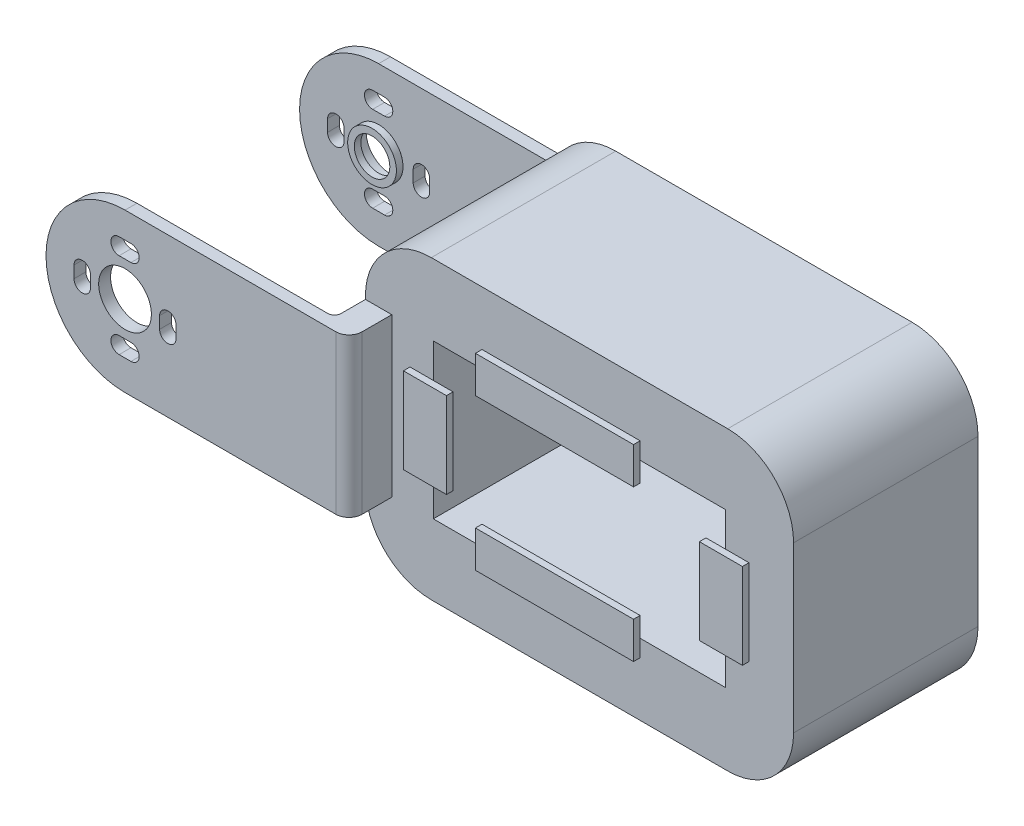
from build123d import *

# Parameters (mm, degrees)
SKETCH_1_W             = 65
SKETCH_1_H             = 45
EXTRUDE_1_DEPTH        = 28
SKETCH_2_W             = 44.4
SKETCH_2_H             = 23.4
CUT_EXTRUDE_1_DEPTH    = 39
SKETCH_3_W             = 4
SKETCH_3_H             = 24
EXTRUDE_2_DEPTH        = 6
EXTRUDE_START          = -0.3
SKETCH_7_R             = 4
EXTRUDE_3_DEPTH        = 1.8
SKETCH_8_W             = 4
SKETCH_8_H             = 24
EXTRUDE_4_DEPTH        = 6
FILLET_1_R             = 10
FILLET_2_R             = 10
FILLET_3_R             = 10
FILLET_4_R             = 10
PATTERN_LINEAR_2_COUNT = 2
PATTERN_LINEAR_2_PITCH = 38.5
FILLET_5_R             = 2
SKETCH_9_R             = 3.7
SKETCH_9_R_2           = 2.7
EXTRUDE_5_DEPTH        = 1
EXTRUDE_6_DEPTH        = 1
EXTRUDE_6_2_DEPTH      = 1
EXTRUDE_6_3_DEPTH      = 1
EXTRUDE_6_4_DEPTH      = 1
EXTRUDE_START_2        = 1.8
SKETCH_12_R            = 4
SKETCH_12_R_2          = 3.7
EXTRUDE_8_DEPTH        = 1.8
SKETCH_15_W            = 4
SKETCH_15_H            = 24
EXTRUDE_10_DEPTH       = 0.5
FILLET_16_R            = 2
FILLET_17_R            = 1
FILLET_18_R            = 1


with BuildPart() as part:
    # 草圖1 → 填料-伸長1 (new body)
    with BuildSketch(Plane.XY):
        with Locations((-27.434655272, 0)):
            Rectangle(SKETCH_1_W, SKETCH_1_H)
    extrude(amount=EXTRUDE_1_DEPTH)

    # 草圖2 → 除料-伸長1 (cut)
    with BuildSketch(Plane.XY):
        with Locations((-27.434655272, 0)):
            Rectangle(SKETCH_2_W, SKETCH_2_H)
    extrude(amount=CUT_EXTRUDE_1_DEPTH, mode=Mode.SUBTRACT)

    # 草圖3 → 填料-伸長2 (add)
    with BuildSketch(Plane.XY.offset(28)):
        with Locations((-57.934655272, 0)):
            Rectangle(SKETCH_3_W, SKETCH_3_H)
    extrude(amount=EXTRUDE_2_DEPTH)

    # 草圖7 → 填料-伸長3 (add)
    with BuildSketch(Plane.XY.offset(33).offset(EXTRUDE_START)):
        with BuildLine():
            Line((-59.934655272, 12), (-59.934655272, -12))
            Line((-59.934655272, -12), (-89.934655272, -12))
            ThreePointArc((-89.934655272, -12), (-101.934655272, 0), (-89.934655272, 12))
            Line((-89.934655272, 12), (-59.934655272, 12))
        make_face()
        with Locations((-89.934655272, 0.3)):
            Circle(SKETCH_7_R, mode=Mode.SUBTRACT)
        with BuildLine():
            Line((-95.184655272, 0.9), (-95.184655272, -0.9))
            ThreePointArc((-95.184655272, -0.9), (-96.434655272, -2.15), (-97.684655272, -0.9))
            Line((-97.684655272, -0.9), (-97.684655272, 0.9))
            ThreePointArc((-97.684655272, 0.9), (-96.434655272, 2.15), (-95.184655272, 0.9))
        make_face(mode=Mode.SUBTRACT)
        with BuildLine():
            Line((-90.834655272, -4.95), (-89.034655272, -4.95))
            ThreePointArc((-89.034655272, -4.95), (-87.784655272, -6.2), (-89.034655272, -7.45))
            Line((-89.034655272, -7.45), (-90.834655272, -7.45))
            ThreePointArc((-90.834655272, -7.45), (-92.084655272, -6.2), (-90.834655272, -4.95))
        make_face(mode=Mode.SUBTRACT)
        with BuildLine():
            Line((-90.834655272, 5.55), (-89.034655272, 5.55))
            ThreePointArc((-89.034655272, 5.55), (-87.784655272, 6.8), (-89.034655272, 8.05))
            Line((-89.034655272, 8.05), (-90.834655272, 8.05))
            ThreePointArc((-90.834655272, 8.05), (-92.084655272, 6.8), (-90.834655272, 5.55))
        make_face(mode=Mode.SUBTRACT)
        with BuildLine():
            Line((-84.684655272, 0.75), (-84.684655272, -1.05))
            ThreePointArc((-84.684655272, -1.05), (-83.434655272, -2.3), (-82.184655272, -1.05))
            Line((-82.184655272, -1.05), (-82.184655272, 0.75))
            ThreePointArc((-82.184655272, 0.75), (-83.434655272, 2), (-84.684655272, 0.75))
        make_face(mode=Mode.SUBTRACT)
    extrude_3 = extrude(amount=EXTRUDE_3_DEPTH)

    # 草圖8 → 填料-伸長4 (add)
    with BuildSketch(Plane(origin=(0, 0, 0), x_dir=(-1, 0, 0), z_dir=(0, 0, -1))):
        with Locations((57.934655272, 0)):
            Rectangle(SKETCH_8_W, SKETCH_8_H)
    extrude(amount=EXTRUDE_4_DEPTH)

    # 圓角1
    fillet_1_edges = [part.edges().sort_by_distance(p)[0] for p in [
        (-59.934655272, -22.5, 14),
    ]]
    fillet(fillet_1_edges, radius=FILLET_1_R)

    # 圓角2
    fillet_2_edges = [part.edges().sort_by_distance(p)[0] for p in [
        (-59.934655272, 22.5, 14),
    ]]
    fillet(fillet_2_edges, radius=FILLET_2_R)

    # 圓角3
    fillet_3_edges = [part.edges().sort_by_distance(p)[0] for p in [
        (5.065344728, 22.5, 14),
    ]]
    fillet(fillet_3_edges, radius=FILLET_3_R)

    # 圓角4
    fillet_4_edges = [part.edges().sort_by_distance(p)[0] for p in [
        (5.065344728, -22.5, 14),
    ]]
    fillet(fillet_4_edges, radius=FILLET_4_R)

    # 直線複製排列2: 填料-伸長3 ×2
    with Locations(*[(0, 0, -i * PATTERN_LINEAR_2_PITCH) for i in range(1, PATTERN_LINEAR_2_COUNT)]):
        add(extrude_3)

    # 圓角5
    fillet_5_edges = [part.edges().sort_by_distance(p)[0] for p in [
        (-55.934655272, 0, -6),
    ]]
    fillet(fillet_5_edges, radius=FILLET_5_R)

    # 草圖12 → 填料-伸長8 (add)
    with BuildSketch(Plane(origin=(0, 0, -4), x_dir=(-1, 0, 0), z_dir=(0, 0, -1)).offset(EXTRUDE_START_2)):
        with Locations(Location((89.934655272, 0.3, 0), (0, 0, 180))):
            Circle(SKETCH_12_R)
        with Locations(Location((89.934655272, 0.3, 0), (0, 0, 180))):
            Circle(SKETCH_12_R_2, mode=Mode.SUBTRACT)
    extrude(amount=-EXTRUDE_8_DEPTH)

    # 草圖15 → 填料-伸長10 (add)
    with BuildSketch(Plane.XY.offset(34)):
        with Locations((-57.934655272, 0)):
            Rectangle(SKETCH_15_W, SKETCH_15_H)
    extrude(amount=EXTRUDE_10_DEPTH)

    # 圓角16
    fillet_16_edges = [part.edges().sort_by_distance(p)[0] for p in [
        (-55.934655272, 0, 34.5),
    ]]
    fillet(fillet_16_edges, radius=FILLET_16_R)

    # 圓角17
    fillet_17_edges = [part.edges().sort_by_distance(p)[0] for p in [
        (-59.934655272, 0, 32.7),
    ]]
    fillet(fillet_17_edges, radius=FILLET_17_R)

    # 圓角18
    fillet_18_edges = [part.edges().sort_by_distance(p)[0] for p in [
        (-59.934655272, 0, -4),
    ]]
    fillet(fillet_18_edges, radius=FILLET_18_R)


with BuildPart() as body_2:
    # 草圖9 → 填料-伸長5 (new body)
    with BuildSketch(Plane.XY.offset(-4)):
        with Locations((-89.934655272, 0.3)):
            Circle(SKETCH_9_R)
        with Locations((-89.934655272, 0.3)):
            Circle(SKETCH_9_R_2, mode=Mode.SUBTRACT)
    extrude(amount=EXTRUDE_5_DEPTH)


with BuildPart() as body_3:
    # 草圖10 → 填料-伸長6 (new body)
    with BuildSketch(Plane.XY.offset(29)):
        Polygon((-42.234655272, 11.7), (-42.234655272, 14.266291238), (-18.234655272, 14.266291238), (-18.234655272, 11.7), (-18.234655272, 8.7), (-42.234655272, 8.7), align=None)
    extrude(amount=-EXTRUDE_6_DEPTH)


with BuildPart() as body_4:
    # 草圖10 → Extrude 6 2 (new body)
    with BuildSketch(Plane.XY.offset(29)):
        Polygon((-49.634655272, 6.5), (-53.165057103, 6.5), (-53.165057103, -6.5), (-49.634655272, -6.5), (-46.634655272, -6.5), (-46.634655272, 6.5), align=None)
    extrude(amount=-EXTRUDE_6_2_DEPTH)


with BuildPart() as body_5:
    # 草圖10 → Extrude 6 3 (new body)
    with BuildSketch(Plane.XY.offset(29)):
        Polygon((-42.234655272, -11.7), (-42.234655272, -8.7), (-18.234655272, -8.7), (-18.234655272, -11.7), (-18.234655272, -14.266291238), (-42.234655272, -14.266291238), align=None)
    extrude(amount=-EXTRUDE_6_3_DEPTH)


with BuildPart() as body_6:
    # 草圖10 → Extrude 6 4 (new body)
    with BuildSketch(Plane.XY.offset(29)):
        Polygon((-5.234655272, 6.5), (-8.234655272, 6.5), (-8.234655272, -6.5), (-5.234655272, -6.5), (-1.70425344, -6.5), (-1.70425344, 6.5), align=None)
    extrude(amount=-EXTRUDE_6_4_DEPTH)


solid = Compound([part.part, body_2.part, body_3.part, body_4.part, body_5.part, body_6.part])
